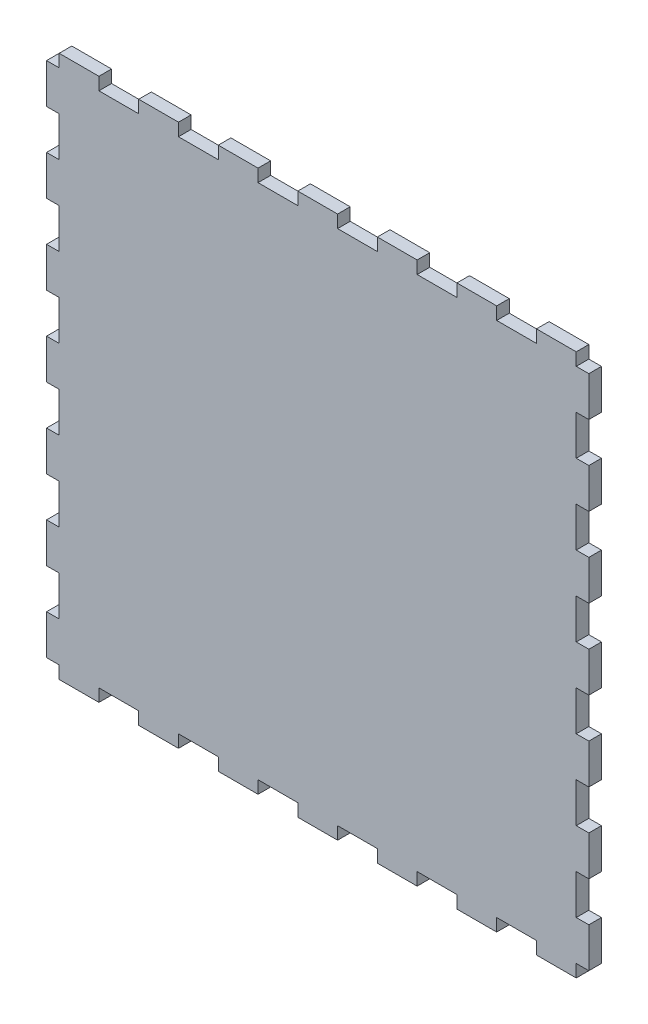
from build123d import *

# Parameters (mm, degrees)
BOSS_EXTRUDE2_DEPTH = 6.096


with BuildPart() as part:
    # Sketch2 → Boss-Extrude2 (new body)
    with BuildSketch(Plane.XY):
        Polygon((0, 19.230769231), (-6.096, 19.230769231), (-6.096, 0), (0, 0), (0, -6.096), (19.230769231, -6.096), (19.230769231, 0), (38.461538462, 0), (38.461538462, -6.096), (57.692307692, -6.096), (57.692307692, 0), (76.923076923, 0), (76.923076923, -6.096), (96.153846154, -6.096), (96.153846154, 0), (115.384615385, 0), (115.384615385, -6.096), (134.615384615, -6.096), (134.615384615, 0), (153.846153846, 0), (153.846153846, -6.096), (173.076923077, -6.096), (173.076923077, 0), (192.307692308, 0), (192.307692308, -6.096), (211.538461538, -6.096), (211.538461538, 0), (230.769230769, 0), (230.769230769, -6.096), (250, -6.096), (250, 0), (256.096, 0), (256.096, 19.230769231), (250, 19.230769231), (250, 38.461538462), (256.096, 38.461538462), (256.096, 57.692307692), (250, 57.692307692), (250, 76.923076923), (256.096, 76.923076923), (256.096, 96.153846154), (250, 96.153846154), (250, 115.384615385), (256.096, 115.384615385), (256.096, 134.615384615), (250, 134.615384615), (250, 153.846153846), (256.096, 153.846153846), (256.096, 173.076923077), (250, 173.076923077), (250, 192.307692308), (256.096, 192.307692308), (256.096, 211.538461538), (250, 211.538461538), (250, 230.769230769), (256.096, 230.769230769), (256.096, 250), (250, 250), (250, 256.096), (230.769230769, 256.096), (230.769230769, 250), (211.538461538, 250), (211.538461538, 256.096), (192.307692308, 256.096), (192.307692308, 250), (173.076923077, 250), (173.076923077, 256.096), (153.846153846, 256.096), (153.846153846, 250), (134.615384615, 250), (134.615384615, 256.096), (115.384615385, 256.096), (115.384615385, 250), (96.153846154, 250), (96.153846154, 256.096), (76.923076923, 256.096), (76.923076923, 250), (57.692307692, 250), (57.692307692, 256.096), (38.461538462, 256.096), (38.461538462, 250), (19.230769231, 250), (19.230769231, 256.096), (0, 256.096), (0, 250), (-6.096, 250), (-6.096, 230.769230769), (0, 230.769230769), (0, 211.538461538), (-6.096, 211.538461538), (-6.096, 192.307692308), (0, 192.307692308), (0, 173.076923077), (-6.096, 173.076923077), (-6.096, 153.846153846), (0, 153.846153846), (0, 134.615384615), (-6.096, 134.615384615), (-6.096, 115.384615385), (0, 115.384615385), (0, 96.153846154), (-6.096, 96.153846154), (-6.096, 76.923076923), (0, 76.923076923), (0, 57.692307692), (-6.096, 57.692307692), (-6.096, 38.461538462), (0, 38.461538462), align=None)
    extrude(amount=BOSS_EXTRUDE2_DEPTH)


solid = part.part
